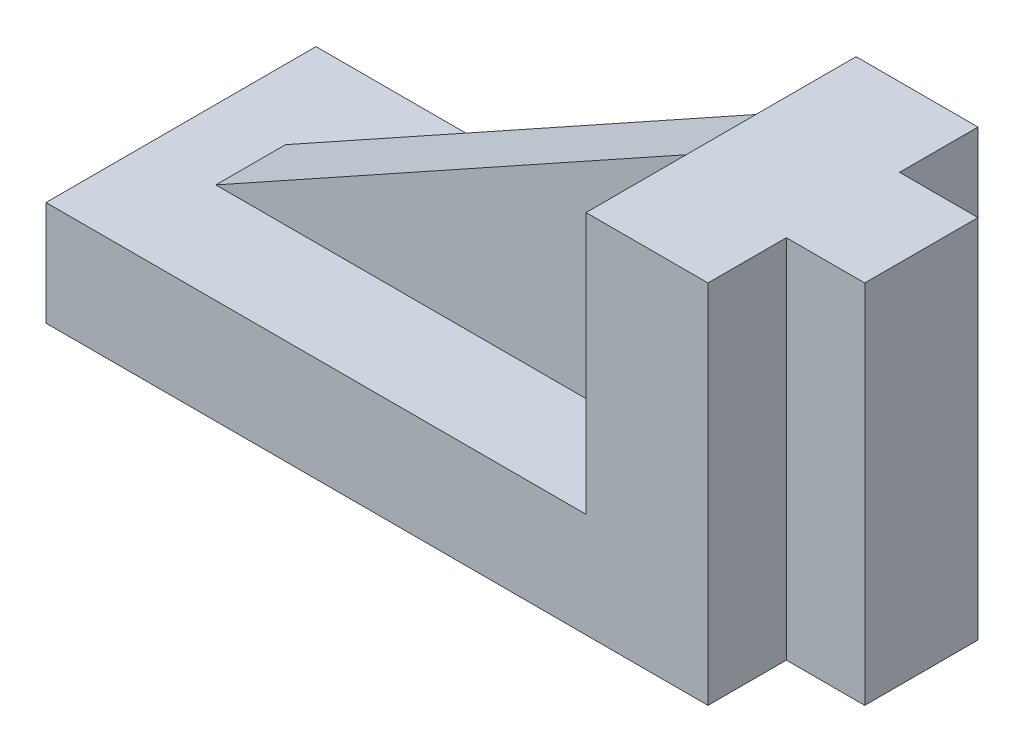
from build123d import *

# Parameters (mm, degrees)
BOSS_EXTRUDE1_DEPTH = 15.5
BOSS_EXTRUDE2_DEPTH = 4
SKETCH3_W           = 9
SKETCH3_H           = 13
BOSS_EXTRUDE3_DEPTH = 42


with BuildPart() as part:
    # Sketch1 → Boss-Extrude1 (new, symmetric)
    with BuildSketch(Plane.XY):
        Polygon((0, 0), (0, 12), (62, 12), (62, 42), (76, 42), (76, 0), align=None)
    extrude(amount=BOSS_EXTRUDE1_DEPTH, both=True)

    # Sketch2 → Boss-Extrude2 (add, symmetric)
    with BuildSketch(Plane.XY):
        Polygon((8, 12), (62, 42), (62, 12), align=None)
    extrude(amount=BOSS_EXTRUDE2_DEPTH, both=True)

    # Sketch3 → Boss-Extrude3 (add, through all)
    with BuildSketch(Plane(origin=(0, 42, 0), x_dir=(1, 0, 0), z_dir=(0, 1, 0))):
        with Locations((80.5, 0)):
            Rectangle(SKETCH3_W, SKETCH3_H)
    extrude(amount=-BOSS_EXTRUDE3_DEPTH)


solid = part.part
